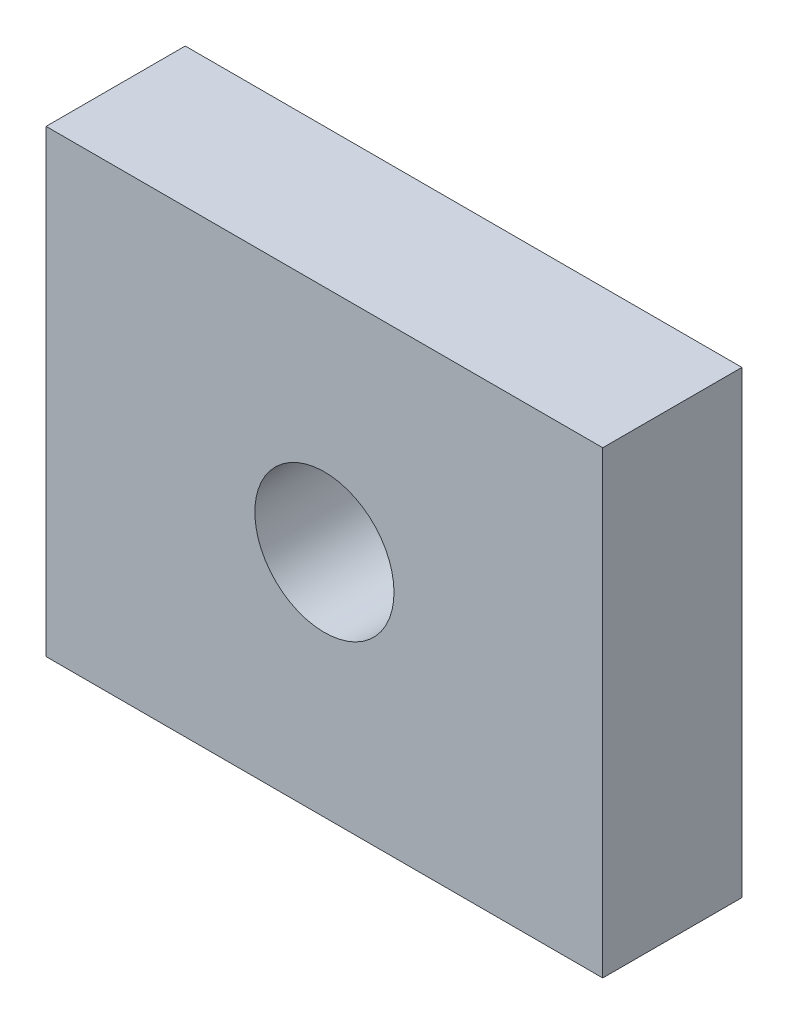
from build123d import *

# Parameters (mm, degrees)
ESQUISSE1_W        = 20
ESQUISSE1_H        = 16.5
ESQUISSE1_R        = 2.5
BOSS_EXTRU_1_DEPTH = 5


with BuildPart() as part:
    # Esquisse1 → Boss.-Extru.1 (new body)
    with BuildSketch(Plane.XY):
        with Locations((10, 8.25)):
            Rectangle(ESQUISSE1_W, ESQUISSE1_H)
        with Locations((10, 8.25)):
            Circle(ESQUISSE1_R, mode=Mode.SUBTRACT)
    extrude(amount=BOSS_EXTRU_1_DEPTH)


solid = part.part
